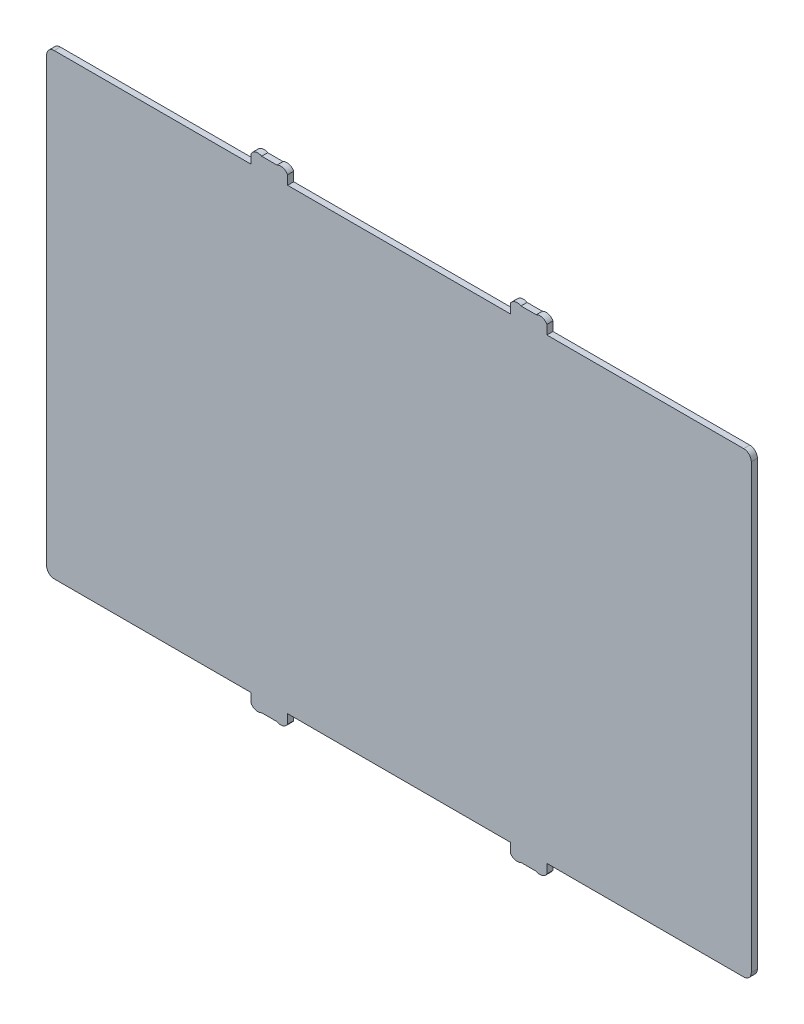
from build123d import *

# Parameters (mm, degrees)
EXTRUDE_1_DEPTH = 4


with BuildPart() as part:
    # Эскиз1 → Бобышка-Вытянуть1 (new body)
    with BuildSketch(Plane.XY):
        with BuildLine():
            Line((177, -66.286621906), (323, -66.286621906))
            Line((323, -66.286621906), (323, -60.286621906))
            ThreePointArc((323, -60.286621906), (326.085786438, -57.836874437), (330, -58.286621906))
            Line((330, -58.286621906), (340, -58.286621906))
            ThreePointArc((340, -58.286621906), (343.914213562, -57.836874437), (347, -60.286621906))
            Line((347, -60.286621906), (347, -66.286621906))
            Line((347, -66.286621906), (476, -66.286621906))
            ThreePointArc((476, -66.286621906), (479.535533906, -67.751088), (481, -71.286621906))
            Line((481, -71.286621906), (481, -361.286621906))
            ThreePointArc((481, -361.286621906), (479.535533906, -364.822155812), (476, -366.286621906))
            Line((476, -366.286621906), (347, -366.286621906))
            Line((347, -366.286621906), (347, -372.286621906))
            ThreePointArc((347, -372.286621906), (343.914213562, -374.736369374), (340, -374.286621906))
            Line((340, -374.286621906), (330, -374.286621906))
            ThreePointArc((330, -374.286621906), (326.085786438, -374.736369374), (323, -372.286621906))
            Line((323, -372.286621906), (323, -366.286621906))
            Line((323, -366.286621906), (177, -366.286621906))
            Line((177, -366.286621906), (177, -372.286621906))
            ThreePointArc((177, -372.286621906), (173.914213562, -374.736369374), (170, -374.286621906))
            Line((170, -374.286621906), (160, -374.286621906))
            ThreePointArc((160, -374.286621906), (156.085786438, -374.736369374), (153, -372.286621906))
            Line((153, -372.286621906), (153, -366.286621906))
            Line((153, -366.286621906), (24, -366.286621906))
            ThreePointArc((24, -366.286621906), (20.464466094, -364.822155812), (19, -361.286621906))
            Line((19, -361.286621906), (19, -71.286621906))
            ThreePointArc((19, -71.286621906), (20.464466094, -67.751088), (24, -66.286621906))
            Line((24, -66.286621906), (153, -66.286621906))
            Line((153, -66.286621906), (153, -60.286621906))
            ThreePointArc((153, -60.286621906), (156.085786438, -57.836874437), (160, -58.286621906))
            Line((160, -58.286621906), (170, -58.286621906))
            ThreePointArc((170, -58.286621906), (173.914213562, -57.836874437), (177, -60.286621906))
            Line((177, -60.286621906), (177, -66.286621906))
        make_face()
    extrude(amount=EXTRUDE_1_DEPTH)


solid = part.part
